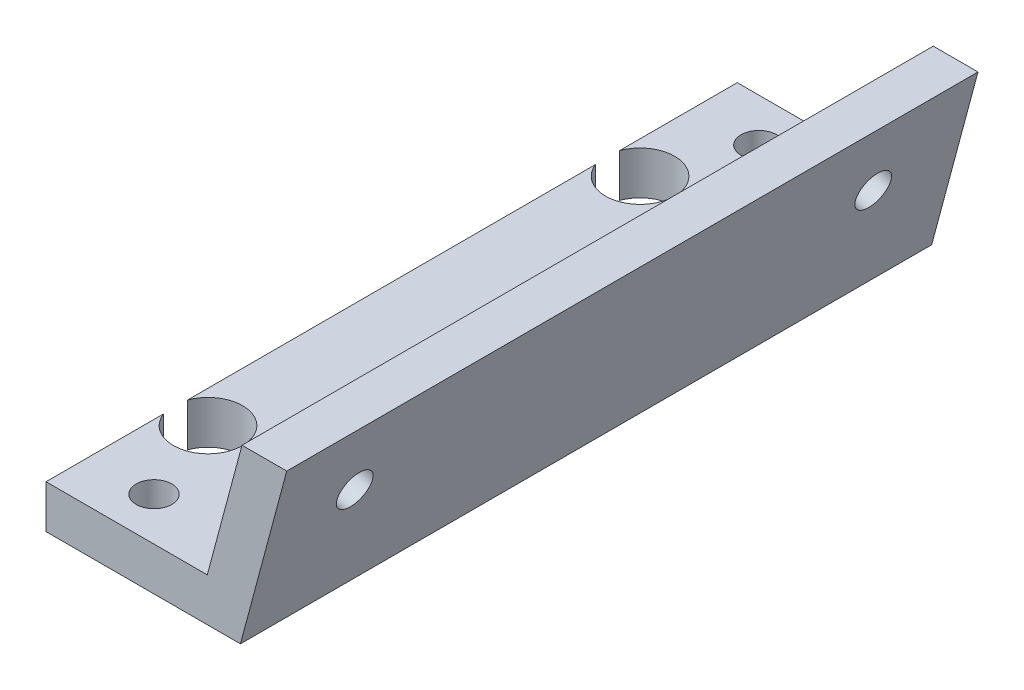
from build123d import *

# Parameters (mm, degrees)
EXTRUDE_START                 = -32
EXTRUDE_15_DEPTH              = 64
CUT_EXTRUDE_1_DEPTH           = 100
CUT_EXTRUDE_1_DEPTH_BACK      = 100
SKETCH_2_R                    = 3.2
CUT_EXTRUDE_1_2_DEPTH         = 100
CUT_EXTRUDE_1_2_DEPTH_BACK    = 100
SKETCH_3_R                    = 3.2
CUT_EXTRUDE_M3_1_DEPTH        = 100
CUT_EXTRUDE_M3_1_DEPTH_BACK   = 100
SKETCH_4_R                    = 1.65
CUT_EXTRUDE_M3_1_2_DEPTH      = 100
CUT_EXTRUDE_M3_1_2_DEPTH_BACK = 100
SKETCH_5_R                    = 1.65
CUT_EXTRUDE_M3_DEPTH          = 12
CUT_EXTRUDE_M3_DEPTH_BACK     = 12
SKETCH_6_R                    = 1.65


with BuildPart() as part:
    # 草图1 → 四毫米底座及15度斜壁 (new body)
    with BuildSketch(Plane.XY.offset(EXTRUDE_START)):
        Polygon((-18, 0), (0, 0), (4.287187079, 16), (0.146082357, 16), (-3.069307952, 4), (-18, 4), align=None)
    extrude(amount=EXTRUDE_15_DEPTH)

    # 草图2 → Cut-Extrude 1 (cut, two sides: drawn at the far end of the back side and taken through both)
    with BuildSketch(Plane(origin=(0, 0, 0), x_dir=(1, 0, 0), z_dir=(0, 1, 0)).offset(-CUT_EXTRUDE_1_DEPTH_BACK)):
        with Locations((-15, 20)):
            Circle(SKETCH_2_R)
    extrude(amount=CUT_EXTRUDE_1_DEPTH + CUT_EXTRUDE_1_DEPTH_BACK, mode=Mode.SUBTRACT)

    # 草图3 → Cut-Extrude 1 2 (cut, two sides: drawn at the far end of the back side and taken through both)
    with BuildSketch(Plane(origin=(0, 0, 0), x_dir=(1, 0, 0), z_dir=(0, 1, 0)).offset(-CUT_EXTRUDE_1_2_DEPTH_BACK)):
        with Locations((-15, -20)):
            Circle(SKETCH_3_R)
    extrude(amount=CUT_EXTRUDE_1_2_DEPTH + CUT_EXTRUDE_1_2_DEPTH_BACK, mode=Mode.SUBTRACT)

    # 草图4 → Cut-Extrude M3__-1 (cut, two sides: drawn at the far end of the back side and taken through both)
    with BuildSketch(Plane(origin=(0, 0, 0), x_dir=(1, 0, 0), z_dir=(0, 1, 0)).offset(-CUT_EXTRUDE_M3_1_DEPTH_BACK)):
        with Locations(Location((-12, 28, 0), (0, 0, 270))):
            Circle(SKETCH_4_R)
    extrude(amount=CUT_EXTRUDE_M3_1_DEPTH + CUT_EXTRUDE_M3_1_DEPTH_BACK, mode=Mode.SUBTRACT)

    # 草图5 → Cut-Extrude M3__1 2 (cut, two sides: drawn at the far end of the back side and taken through both)
    with BuildSketch(Plane(origin=(0, 0, 0), x_dir=(1, 0, 0), z_dir=(0, 1, 0)).offset(-CUT_EXTRUDE_M3_1_2_DEPTH_BACK)):
        with Locations(Location((-12, -28, 0), (0, 0, 270))):
            Circle(SKETCH_5_R)
    extrude(amount=CUT_EXTRUDE_M3_1_2_DEPTH + CUT_EXTRUDE_M3_1_2_DEPTH_BACK, mode=Mode.SUBTRACT)

    # 草图6 → 长脚斜面双M3孔 (cut, two sides: drawn at the far end of the back side and taken through both)
    with BuildSketch(Plane(origin=(0, 0, 0), x_dir=(0, 0, -1), z_dir=(0.9659258262890684, -0.2588190451025208, 0)).offset(-CUT_EXTRUDE_M3_DEPTH_BACK)):
        with Locations(Location((24, 10, 0), (0, 0, 90))):
            Circle(SKETCH_6_R)
        with Locations(Location((-24, 10, 0), (0, 0, 90))):
            Circle(SKETCH_6_R)
    extrude(amount=CUT_EXTRUDE_M3_DEPTH + CUT_EXTRUDE_M3_DEPTH_BACK, mode=Mode.SUBTRACT)


solid = part.part
